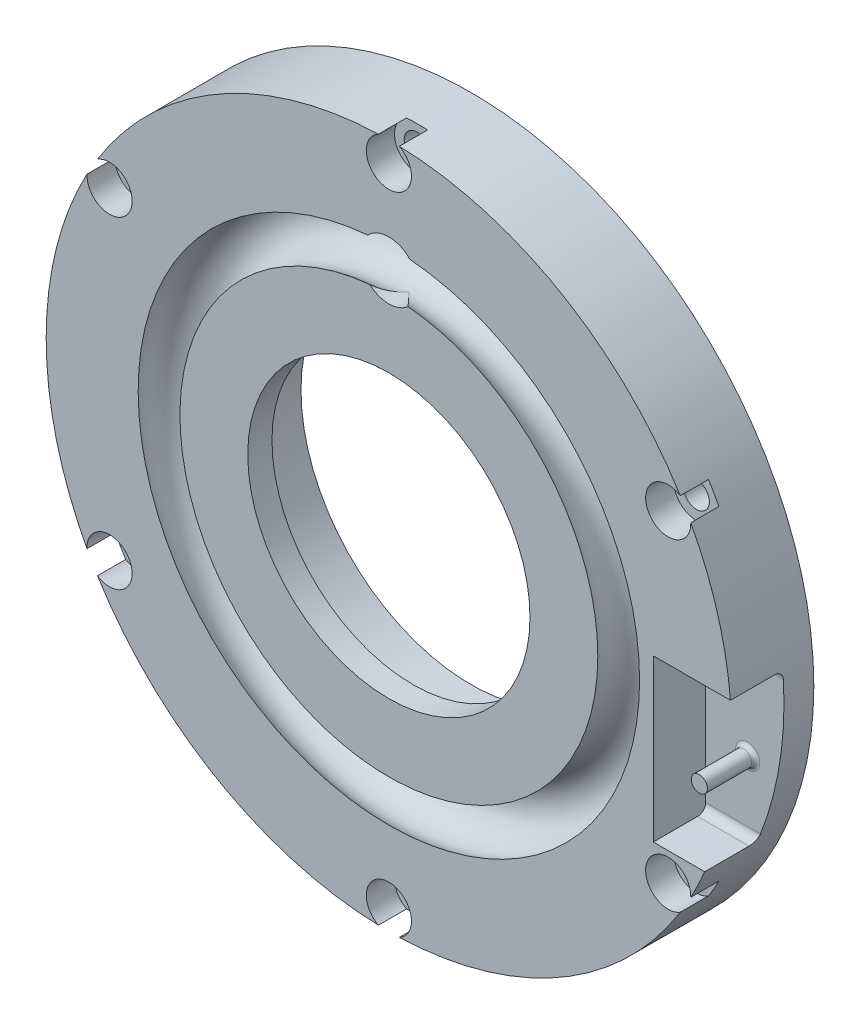
from build123d import *

# Parameters (mm, degrees)
SKETCH1_R            = 42.50000000000227
SKETCH1_R_2          = 1.6000000000000214
SKETCH1_R_3          = 1.6000000000000199
SKETCH1_R_4          = 1.6000000000000134
SKETCH1_R_5          = 1.6000000000000174
SKETCH1_R_6          = 1.5999999999999819
SKETCH1_R_7          = 1.6000000000000256
SKETCH1_R_8          = 17.499999999999996
BOSS_EXTRUDE1_DEPTH  = 3
BOSS_EXTRUDE3_START  = 7.2
SKETCH2_R            = 42.50000000000227
SKETCH2_R_2          = 37.50000000000225
SKETCH2_R_3          = 1.6000000000000214
SKETCH2_R_4          = 1.6000000000000199
SKETCH2_R_5          = 1.6000000000000174
SKETCH2_R_6          = 1.6000000000000256
SKETCH2_R_7          = 1.599999999999982
SKETCH2_R_8          = 1.6000000000000132
SKETCH2_R_9          = 24.10000000000001
SKETCH2_R_10         = 21.10000000000001
BOSS_EXTRUDE3_DEPTH  = 7.2
SKETCH4_R            = 37.500000000002274
SKETCH4_R_2          = 24.100000000000005
BOSS_EXTRUDE4_DEPTH  = 7.2
SKETCH3_R            = 2.8000000000000083
SKETCH3_R_2          = 2.7999999999999874
SKETCH3_R_3          = 2.799999999999999
SKETCH3_R_4          = 2.800000000000002
SKETCH3_R_5          = 2.7999999999999847
CUT_EXTRUDE1_DEPTH   = 3.5
CUT_SWEEP1_PROFILE_R = 3.6
CUT_EXTRUDE2_REACH   = 371.066
SKETCH22_R           = 3.6000000000000143
SKETCH23_R           = 37.50000000000225
SKETCH23_R_2         = 24.10000000000001
CUT_EXTRUDE3_DEPTH   = 3
FILLET1_R            = 1.5
CUT_EXTRUDE4_START   = -6.5
CUT_EXTRUDE4_DEPTH   = 6.5
SKETCH26_R           = 0.9999999999999983
BOSS_EXTRUDE6_DEPTH  = 6
FILLET2_R            = 0.5
FILLET3_R            = 1


with BuildPart() as part:
    # Sketch1 → Boss-Extrude1 (new body)
    with BuildSketch(Plane.XY):
        with Locations((-319.7082495586111, 27.57863172929923)):
            Circle(SKETCH1_R)
        with Locations((-285.0672334072322, 47.578631729303034)):
            Circle(SKETCH1_R_2, mode=Mode.SUBTRACT)
        with Locations((-285.0672334072285, 7.578631729299956)):
            Circle(SKETCH1_R_3, mode=Mode.SUBTRACT)
        with Locations((-319.708249558607, -12.42136827070478)):
            Circle(SKETCH1_R_4, mode=Mode.SUBTRACT)
        with Locations((-354.34926570998897, 7.578631729293746)):
            Circle(SKETCH1_R_5, mode=Mode.SUBTRACT)
        with Locations((-354.34926570999244, 47.57863172929688)):
            Circle(SKETCH1_R_6, mode=Mode.SUBTRACT)
        with Locations((-319.7082495586139, 67.57863172930129)):
            Circle(SKETCH1_R_7, mode=Mode.SUBTRACT)
        with Locations((-319.7082495586111, 27.57863172929923)):
            Circle(SKETCH1_R_8, mode=Mode.SUBTRACT)
    extrude(amount=BOSS_EXTRUDE1_DEPTH)

    # Sketch2 → Boss-Extrude3 (add)
    # profile 1 of 2: a face of its own
    with BuildSketch(Plane(origin=(0, 0, 0), x_dir=(-1, 0, 0), z_dir=(0, 0, -1)).offset(BOSS_EXTRUDE3_START)):
        with Locations((319.7082495586111, 27.57863172929923)):
            Circle(SKETCH2_R)
        with Locations((319.7082495586111, 27.57863172929923)):
            Circle(SKETCH2_R_2, mode=Mode.SUBTRACT)
        with Locations((285.0672334072322, 47.578631729303034)):
            Circle(SKETCH2_R_3, mode=Mode.SUBTRACT)
        with Locations((285.0672334072285, 7.578631729299956)):
            Circle(SKETCH2_R_4, mode=Mode.SUBTRACT)
        with Locations((354.34926570998897, 7.578631729293746)):
            Circle(SKETCH2_R_5, mode=Mode.SUBTRACT)
        with Locations((319.7082495586139, 67.57863172930129)):
            Circle(SKETCH2_R_6, mode=Mode.SUBTRACT)
        with Locations((354.34926570999244, 47.57863172929688)):
            Circle(SKETCH2_R_7, mode=Mode.SUBTRACT)
        with Locations((319.708249558607, -12.42136827070478)):
            Circle(SKETCH2_R_8, mode=Mode.SUBTRACT)
    # profile 2 of 2: a face of its own
    with BuildSketch(Plane(origin=(0, 0, 0), x_dir=(-1, 0, 0), z_dir=(0, 0, -1)).offset(BOSS_EXTRUDE3_START)):
        with Locations(Location((319.7082495586111, 27.57863172929923, 0), (0, 0, 180))):
            Circle(SKETCH2_R_9)
        with Locations((319.7082495586111, 27.57863172929923)):
            Circle(SKETCH2_R_10, mode=Mode.SUBTRACT)
    extrude(amount=-BOSS_EXTRUDE3_DEPTH)

    # Sketch4 → Boss-Extrude4 (add)
    with BuildSketch(Plane(origin=(0, 0, -7.2), x_dir=(-1, 0, 0), z_dir=(0, 0, -1))):
        with Locations((319.7082495586111, 27.57863172929923)):
            Circle(SKETCH4_R)
        with Locations((319.7082495586111, 27.57863172929923)):
            Circle(SKETCH4_R_2, mode=Mode.SUBTRACT)
    extrude(amount=-BOSS_EXTRUDE4_DEPTH)

    # Sketch3 → Cut-Extrude1 (cut)
    with BuildSketch(Plane.XY.offset(3)):
        with Locations((-285.0672334072322, 47.578631729303034)):
            Circle(SKETCH3_R)
        with Locations((-285.0672334072269, 7.578631729303897)):
            Circle(SKETCH3_R_2)
        with Locations((-319.7082495586012, -12.42136827070006)):
            Circle(SKETCH3_R_3)
        with Locations((-354.34926570998056, 7.578631729295106)):
            Circle(SKETCH3_R_4)
        with Locations((-354.34926570998545, 47.57863172929427)):
            Circle(SKETCH3_R_2)
        with Locations((-319.7082495586111, 67.57863172929795)):
            Circle(SKETCH3_R_5)
    extrude(amount=-CUT_EXTRUDE1_DEPTH, mode=Mode.SUBTRACT)

    # Cut-Sweep1: sweep along a path in Sketch5
    with BuildLine(Plane.XY.offset(0.5)) as cut_sweep1_path:
        CenterArc((-319.7082495586111, 27.57863172929923), 28.500000000002245, 0, 360)
    # Cut-Sweep1 profile (on start of the path) → Cut-Sweep1 (sweep, cut)
    with BuildSketch(Plane(origin=(-291.2082495586088, 27.57863172929923, 0.5), x_dir=(0, 0, 1), z_dir=(0, 1, 0))):
        Circle(CUT_SWEEP1_PROFILE_R)
    sweep(path=cut_sweep1_path.line, mode=Mode.SUBTRACT)

    # Sketch22 → Cut-Extrude2 (cut, up to next)
    with BuildSketch(Plane.XY.offset(3), mode=Mode.PRIVATE) as cut_extrude2_sk1:
        with Locations((-319.7082495586111, 56.07863172930147)):
            Circle(SKETCH22_R)
    cut_extrude2_tool1 = extrude(cut_extrude2_sk1.sketch, amount=-CUT_EXTRUDE2_REACH, mode=Mode.PRIVATE) & part.part
    add(cut_extrude2_tool1.solids().sort_by_distance((-319.70825, 56.078632, 3))[0], mode=Mode.SUBTRACT)
    add(cut_extrude2_tool1.solids().sort_by_distance((-319.70825, 56.078632, 3))[1], mode=Mode.SUBTRACT)

    # Sketch23 → Cut-Extrude3 (cut)
    with BuildSketch(Plane(origin=(0, 0, -7.2), x_dir=(-1, 0, 0), z_dir=(0, 0, -1))):
        with Locations((319.7082495586111, 27.57863172929923)):
            Circle(SKETCH23_R)
        with Locations((319.7082495586111, 27.57863172929923)):
            Circle(SKETCH23_R_2, mode=Mode.SUBTRACT)
    extrude(amount=-CUT_EXTRUDE3_DEPTH, mode=Mode.SUBTRACT)

    # Fillet1
    fillet1_edges = [part.edges().sort_by_distance(p)[0] for p in [
        (-282.2082495586088, 27.578631729299232, -4.2),
        (-295.6082495586111, 27.578631729299232, -4.2),
    ]]
    fillet(fillet1_edges, radius=FILLET1_R)

    # Sketch24 → Cut-Extrude4 (cut)
    with BuildSketch(Plane.XY.offset(3).offset(CUT_EXTRUDE4_START)):
        with BuildLine():
            Line((-286.9146608641175, 31.078631729299236), (-286.9146608641175, 12.578631729299232))
            Line((-286.9146608641175, 12.578631729299232), (-286.9146608641175, 11.078631729299234))
            Line((-286.9146608641175, 11.078631729299234), (-280.54193750347633, 11.078631729299234))
            ThreePointArc((-280.54193750347633, 11.078631729299234), (-277.7385336752559, 20.88587828466693), (-277.3526123895141, 31.078631729299236))
            Line((-277.3526123895141, 31.078631729299236), (-286.9146608641175, 31.078631729299236))
        make_face()
    extrude(amount=CUT_EXTRUDE4_DEPTH, mode=Mode.SUBTRACT)

    # Sketch26 → Boss-Extrude6 (add)
    with BuildSketch(Plane.XY.offset(-3.4999999999999996)):
        with Locations((-281.7109467373067, 19.678599736614537)):
            Circle(SKETCH26_R)
    extrude(amount=BOSS_EXTRUDE6_DEPTH)

    # Fillet2
    fillet2_edges = [part.edges().sort_by_distance(p)[0] for p in [
        (-282.7109467373067, 19.678599736614537, -3.4999999999999996),
    ]]
    fillet(fillet2_edges, radius=FILLET2_R)

    # Fillet3
    fillet3_edges = [part.edges().sort_by_distance(p)[0] for p in [
        (-283.72829918379693, 11.078631729299234, -3.5),
        (-282.1336366268158, 31.078631729299236, -3.5),
    ]]
    fillet(fillet3_edges, radius=FILLET3_R)


solid = part.part
